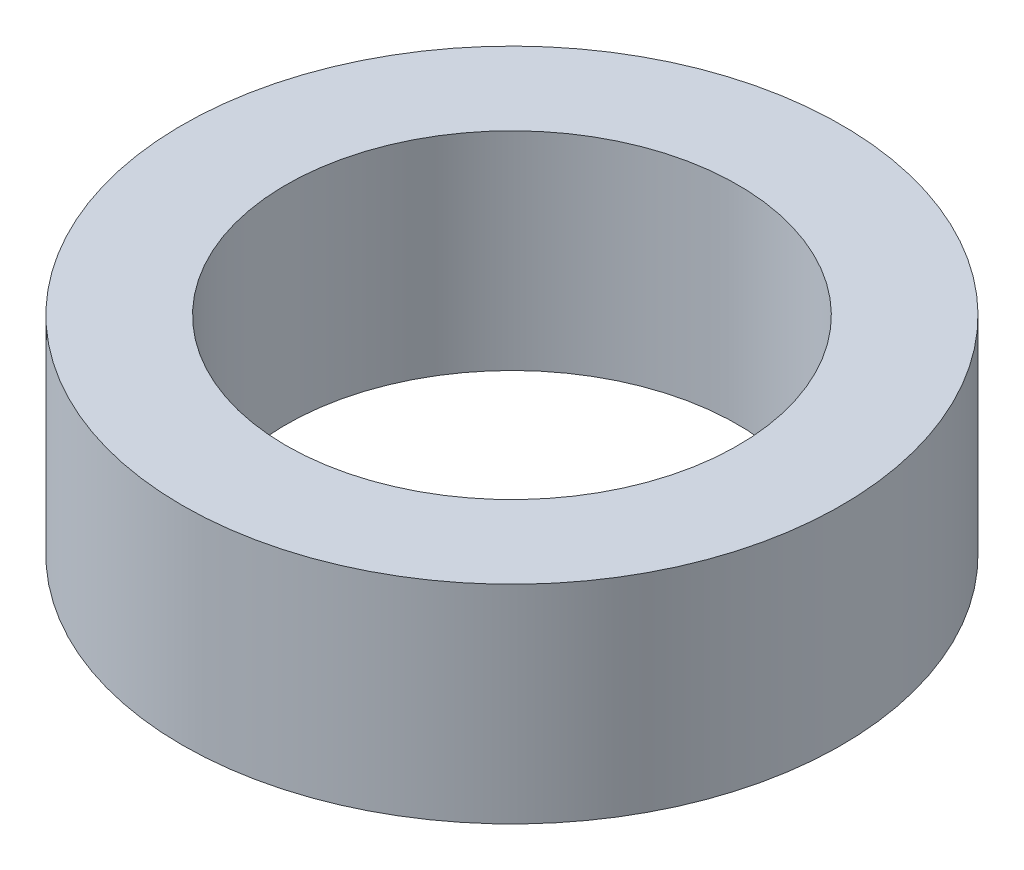
from build123d import *

# Parameters (mm, degrees)
SKETCH1_R           = 4.7625
SKETCH1_R_2         = 3.2639
BOSS_EXTRUDE1_DEPTH = 3


with BuildPart() as part:
    # Sketch1 → Boss-Extrude1 (new body)
    with BuildSketch(Plane(origin=(0, 0, 0), x_dir=(1, 0, 0), z_dir=(0, 1, 0))):
        with Locations(Location((0, 0, 0), (0, 0, 270))):
            Circle(SKETCH1_R)
        with Locations(Location((0, 0, 0), (0, 0, 270))):
            Circle(SKETCH1_R_2, mode=Mode.SUBTRACT)
    extrude(amount=BOSS_EXTRUDE1_DEPTH)


solid = part.part
